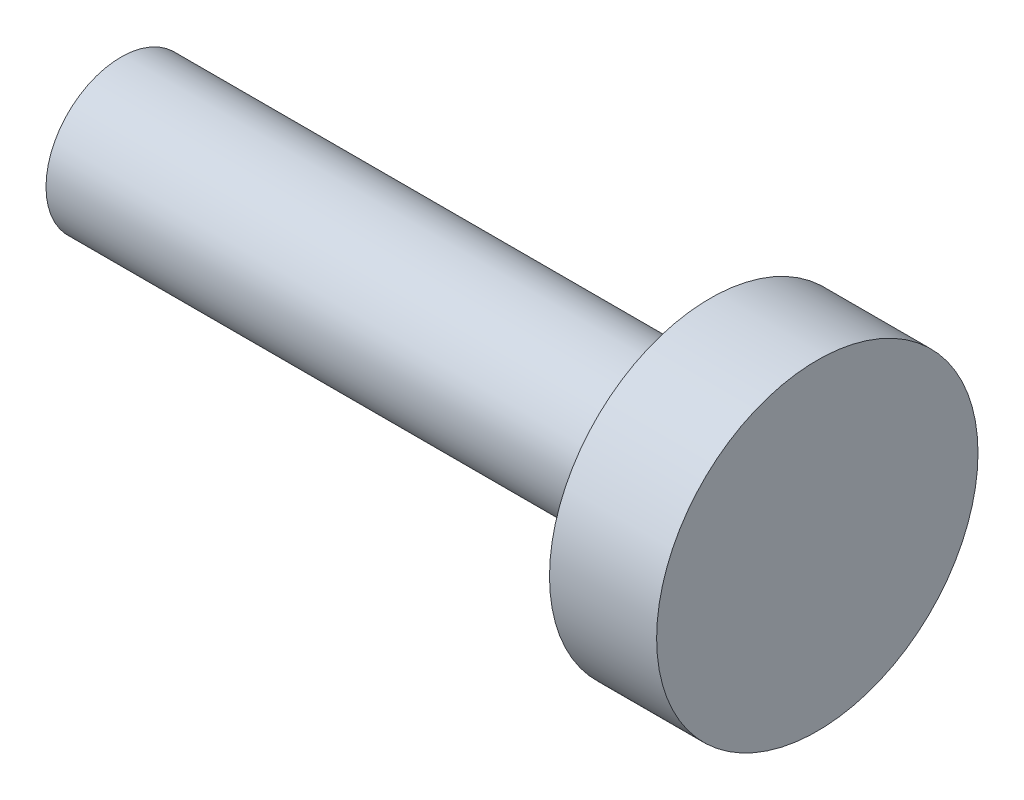
from build123d import *

# Parameters (mm, degrees)
SKETCH1_W = 11
SKETCH1_H = 1.4


with BuildPart() as part:
    # Sketch1 → Revolve1 (revolve)
    with BuildSketch(Plane.XY, mode=Mode.PRIVATE) as revolve1_sk:
        Polygon((14.449152542, 1.4), (14.449152542, 0), (16.449152542, 0), (16.449152542, 3), (14.449152542, 3), align=None)
        with Locations((8.949152542, 0.7)):
            Rectangle(SKETCH1_W, SKETCH1_H)
    revolve(revolve1_sk.sketch.rotate(Axis((0, 0, 0), (1, 0, 0)), 90), axis=Axis((0, 0, 0), (1, 0, 0)))


solid = part.part
